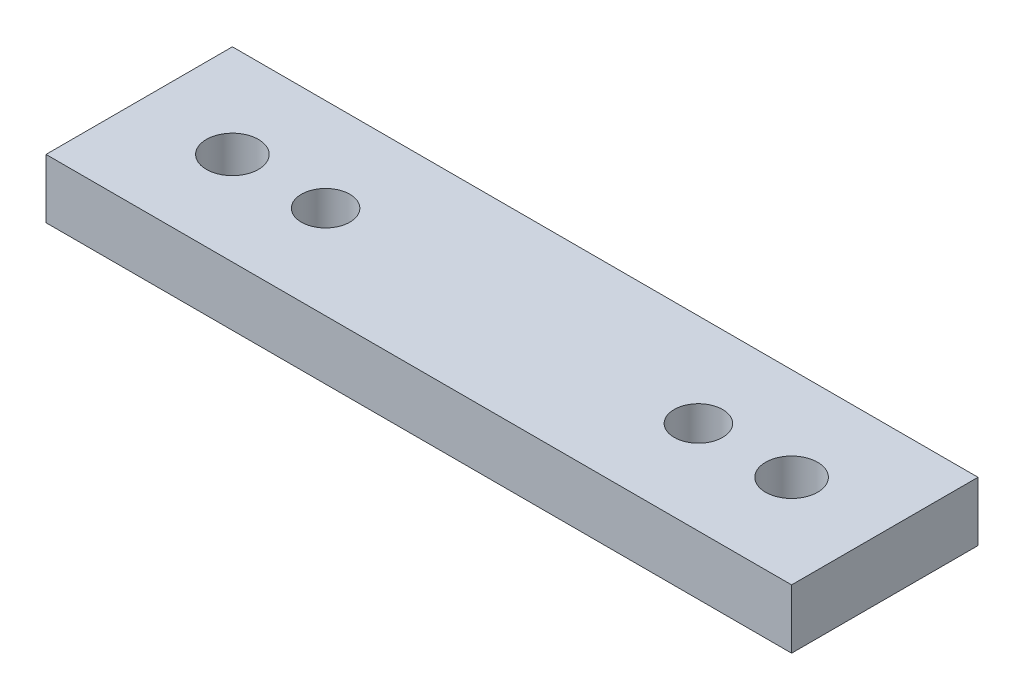
from build123d import *

# Parameters (mm, degrees)
BOSS_EXTRUDE1_DEPTH      = 3.175
BOSS_EXTRUDE1_DEPTH_BACK = 3.175
SKETCH1_W                = 80
SKETCH1_H                = 20
SKETCH1_R                = 2.794
SKETCH1_R_2              = 2.6


with BuildPart() as part:
    # Sketch1 → Boss-Extrude1 (new, two sides: drawn at the far end of the back side and taken through both)
    with BuildSketch(Plane(origin=(0, 0, 0), x_dir=(1, 0, 0), z_dir=(0, 1, 0)).offset(-BOSS_EXTRUDE1_DEPTH_BACK)):
        Rectangle(SKETCH1_W, SKETCH1_H)
        with Locations((-30, 0)):
            Circle(SKETCH1_R, mode=Mode.SUBTRACT)
        with Locations((30, 0)):
            Circle(SKETCH1_R, mode=Mode.SUBTRACT)
        with Locations((-20, 0)):
            Circle(SKETCH1_R_2, mode=Mode.SUBTRACT)
        with Locations((20, 0)):
            Circle(SKETCH1_R_2, mode=Mode.SUBTRACT)
    extrude(amount=BOSS_EXTRUDE1_DEPTH + BOSS_EXTRUDE1_DEPTH_BACK)


solid = part.part
